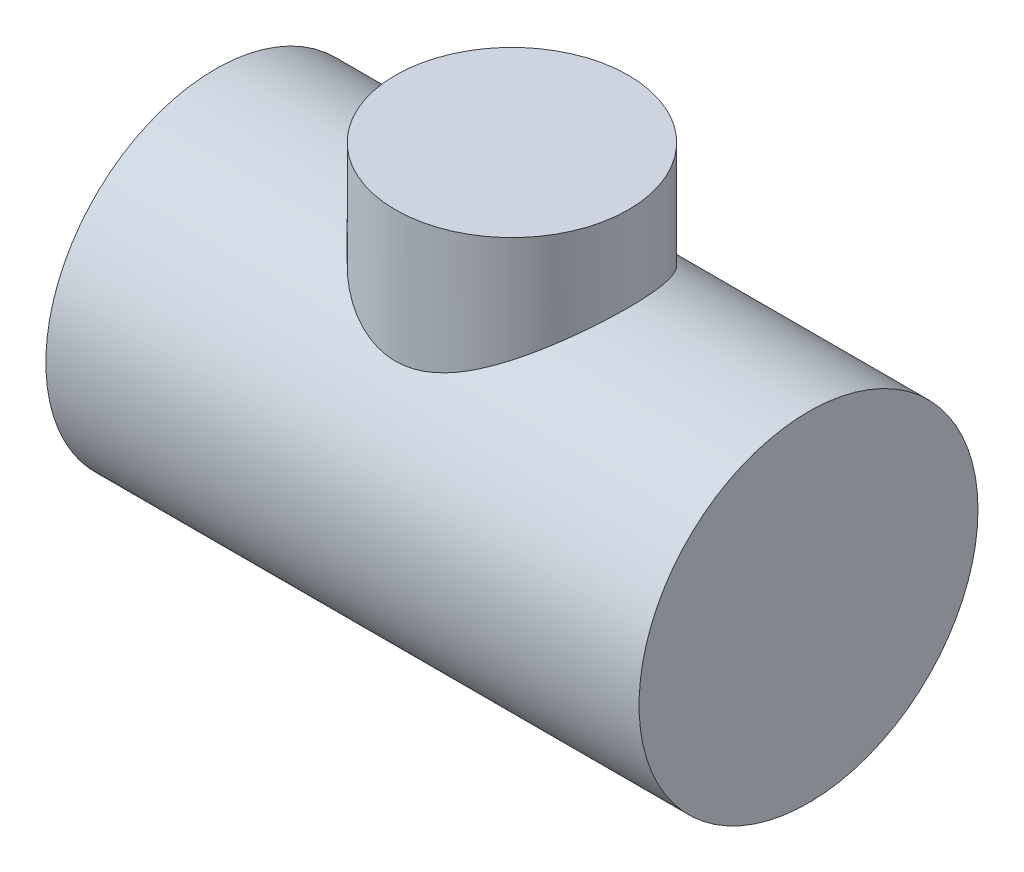
from build123d import *

# Parameters (mm, degrees)
SKETCH1_R           = 50.8
BOSS_EXTRUDE1_DEPTH = 88.9
SKETCH2_R           = 34.925
BOSS_EXTRUDE2_DEPTH = 76.2


with BuildPart() as part:
    # Sketch1 → Boss-Extrude1 (new, symmetric)
    with BuildSketch(Plane(origin=(0, 0, 0), x_dir=(0, 0, -1), z_dir=(1, 0, 0))):
        Circle(SKETCH1_R)
    extrude(amount=BOSS_EXTRUDE1_DEPTH, both=True)

    # Sketch2 → Boss-Extrude2 (add)
    with BuildSketch(Plane(origin=(0, 0, 0), x_dir=(1, 0, 0), z_dir=(0, 1, 0))):
        with Locations(Location((0, 0, 0), (0, 0, 90))):
            Circle(SKETCH2_R)
    extrude(amount=BOSS_EXTRUDE2_DEPTH)


solid = part.part
